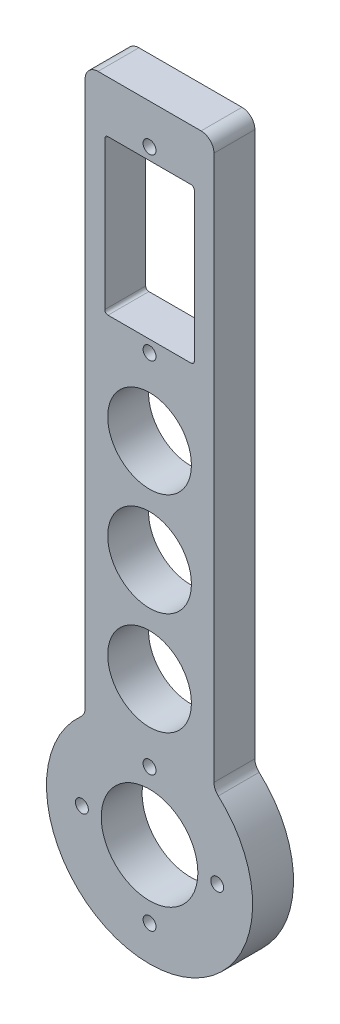
from build123d import *

# Parameters (mm, degrees)
SKETCH1_R           = 1
BOSS_EXTRUDE1_DEPTH = 6.35
SKETCH2_W           = 13.9
SKETCH2_H           = 24
SKETCH2_R           = 1
CUT_EXTRUDE1_DEPTH  = 102.470796291
FILLET1_R           = 0.5
FILLET2_R           = 2
SKETCH3_R           = 6.5
CUT_EXTRUDE2_DEPTH  = 6.35
SKETCH4_R           = 7.5
CUT_EXTRUDE3_DEPTH  = 102.470796291


with BuildPart() as part:
    # Sketch1 → Boss-Extrude1 (new body)
    with BuildSketch(Plane.XY):
        with BuildLine():
            Line((-10, 12.489995997), (-10, 100))
            Line((-10, 100), (10, 100))
            Line((10, 100), (10, 12.489995997))
            ThreePointArc((10, 12.489995997), (0, -16), (-10, 12.489995997))
        make_face()
        with Locations((-10.5, 0)):
            Circle(SKETCH1_R, mode=Mode.SUBTRACT)
        with Locations((0, 10.5)):
            Circle(SKETCH1_R, mode=Mode.SUBTRACT)
        with Locations((10.5, 0)):
            Circle(SKETCH1_R, mode=Mode.SUBTRACT)
        with Locations((0, -10.5)):
            Circle(SKETCH1_R, mode=Mode.SUBTRACT)
    extrude(amount=BOSS_EXTRUDE1_DEPTH)

    # Sketch2 → Cut-Extrude1 (cut, through all)
    with BuildSketch(Plane.XY.offset(6.35)):
        with Locations((0, 80)):
            Rectangle(SKETCH2_W, SKETCH2_H)
        with Locations((0, 66.15)):
            Circle(SKETCH2_R)
        with Locations((0, 93.85)):
            Circle(SKETCH2_R)
    extrude(amount=-CUT_EXTRUDE1_DEPTH, mode=Mode.SUBTRACT)

    # Fillet1
    fillet1_edges = [part.edges().sort_by_distance(p)[0] for p in [
        (6.95, 92, 3.175),
        (6.95, 68, 3.175),
        (-6.95, 68, 3.175),
        (-6.95, 92, 3.175),
    ]]
    fillet(fillet1_edges, radius=FILLET1_R)

    # Fillet2
    fillet2_edges = [part.edges().sort_by_distance(p)[0] for p in [
        (-10, 12.489995997, 3.175),
        (10, 12.489995997, 3.175),
        (10, 100, 3.175),
        (-10, 100, 3.175),
    ]]
    fillet(fillet2_edges, radius=FILLET2_R)

    # Sketch3 → Cut-Extrude2 (cut)
    with BuildSketch(Plane.XY.offset(6.35)):
        with Locations((0, 38.325)):
            Circle(SKETCH3_R)
        with Locations((0, 54.325)):
            Circle(SKETCH3_R)
        with Locations((0, 22.325)):
            Circle(SKETCH3_R)
    extrude(amount=-CUT_EXTRUDE2_DEPTH, mode=Mode.SUBTRACT)

    # Sketch4 → Cut-Extrude3 (cut, through all)
    with BuildSketch(Plane.XY.offset(6.35)):
        Circle(SKETCH4_R)
    extrude(amount=-CUT_EXTRUDE3_DEPTH, mode=Mode.SUBTRACT)


solid = part.part
